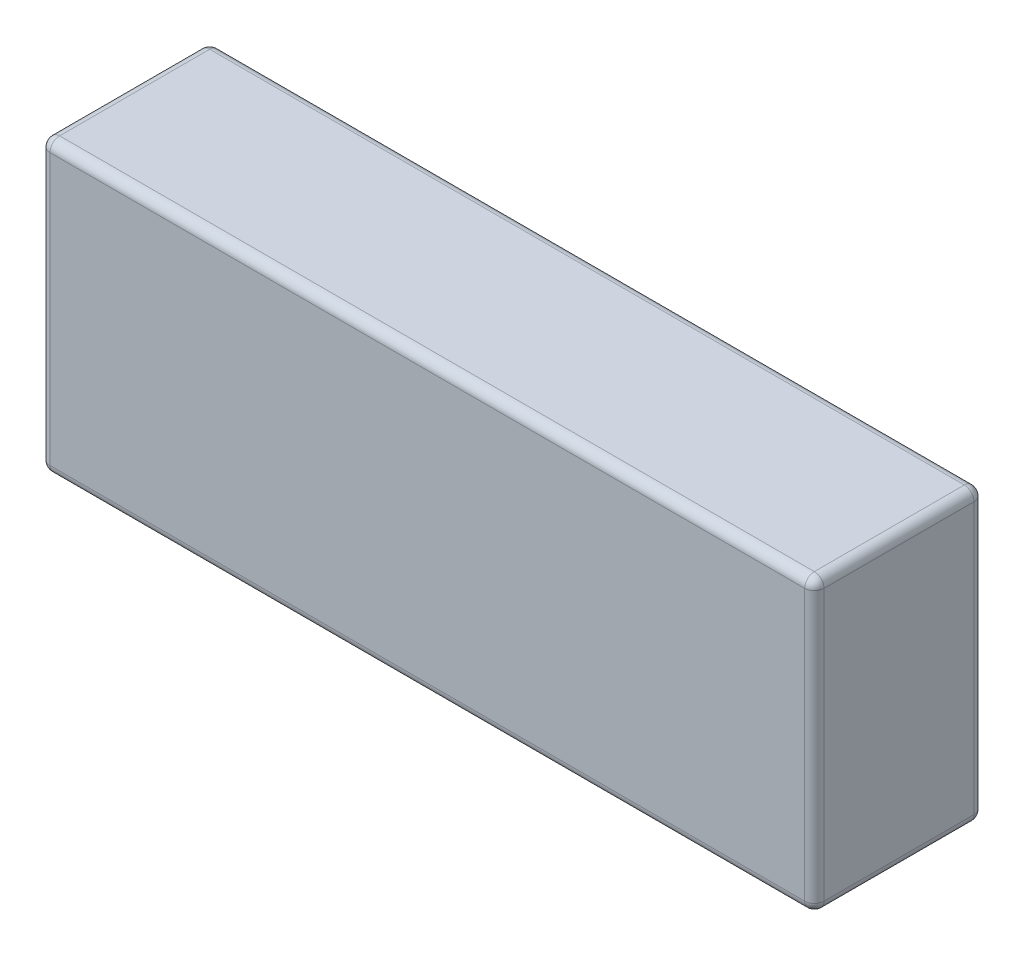
from build123d import *

# Parameters (mm, degrees)
ESQUISSE1_W        = 160
ESQUISSE1_H        = 60
BOSS_EXTRU_1_DEPTH = 35
CONG_1_R           = 2


with BuildPart() as part:
    # Esquisse1 → Boss.-Extru.1 (new body)
    with BuildSketch(Plane.XY):
        with Locations((80, 30)):
            Rectangle(ESQUISSE1_W, ESQUISSE1_H)
    extrude(amount=BOSS_EXTRU_1_DEPTH)

    # Congé1
    cong_1_edges = [part.edges().sort_by_distance(p)[0] for p in [
        (160, 30, 35),
        (80, 60, 35),
        (0, 30, 35),
        (80, 60, 0),
        (160, 30, 0),
        (80, 0, 0),
        (0, 30, 0),
        (0, 60, 17.5),
        (160, 60, 17.5),
        (160, 0, 17.5),
        (0, 0, 17.5),
        (80, 0, 35),
    ]]
    fillet(cong_1_edges, radius=CONG_1_R)


solid = part.part
